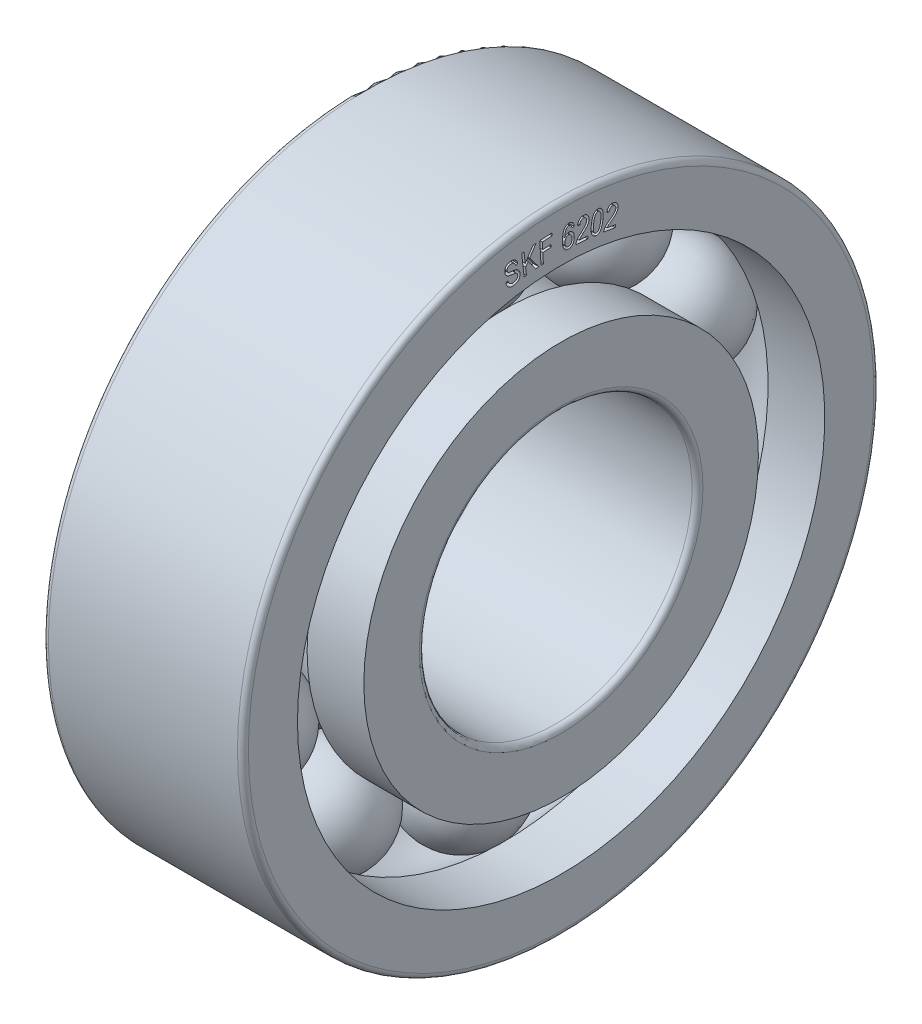
from build123d import *

# Parameters (mm, degrees)
FILLET1_R          = 0.3
FILLET2_R          = 0.3
CIRPATTERN2_COUNT  = 10
CUT_EXTRUDE1_DEPTH = 0.3


with BuildPart() as part:
    # Sketch1 → Revolve1 (revolve)
    with BuildSketch(Plane.XY, mode=Mode.PRIVATE) as revolve1_sk:
        with BuildLine():
            Line((0, 14.5), (3.118955061, 14.5))
            ThreePointArc((3.118955061, 14.5), (5.5, 15.675), (7.881044939, 14.5))
            Line((7.881044939, 14.5), (11, 14.5))
            Line((11, 14.5), (11, 17.5))
            Line((11, 17.5), (0, 17.5))
            Line((0, 17.5), (0, 14.5))
        make_face()
        with BuildLine():
            Line((0, 7.5), (11, 7.5))
            Line((11, 7.5), (11, 10.85))
            Line((11, 10.85), (7.881044939, 10.85))
            ThreePointArc((7.881044939, 10.85), (5.5, 9.675), (3.118955061, 10.85))
            Line((3.118955061, 10.85), (0, 10.85))
            Line((0, 10.85), (0, 7.5))
        make_face()
    revolve(revolve1_sk.sketch.rotate(Axis((0, 0, 0), (1, 0, 0)), 90), axis=Axis((0, 0, 0), (1, 0, 0)))

    # Fillet1
    fillet1_edges = [part.edges().sort_by_distance(p)[0] for p in [
        (0, 0, -17.5),
        (11, 0, -17.5),
    ]]
    fillet(fillet1_edges, radius=FILLET1_R)

    # Fillet2
    fillet2_edges = [part.edges().sort_by_distance(p)[0] for p in [
        (11, 0, -7.5),
        (0, 0, -7.5),
    ]]
    fillet(fillet2_edges, radius=FILLET2_R)

    # Sketch4 → Cut-Extrude1 (cut)
    # profile 1 of 7: a face of its own
    with BuildSketch(Plane(origin=(11, 0, 0), x_dir=(0, 0, -1), z_dir=(1, 0, 0))):
        with BuildLine():
            Line((-3.044063134, 15.181571735), (-2.925231965, 15.215662644))
            add(Edge.make_bspline(
                [(-2.925231965, 15.215662644), (-2.920744006, 15.200541273), (-2.912237957, 15.171881672), (-2.895514226, 15.132702536), (-2.877240484, 15.099030284), (-2.855883638, 15.071077612), (-2.831680525, 15.048058603), (-2.804827891, 15.028471628), (-2.774527306, 15.012732784), (-2.741556454, 15.000118472), (-2.706261244, 14.991242517), (-2.669260918, 14.987288139), (-2.630991469, 14.987367482), (-2.605400164, 14.991002012), (-2.592358588, 14.992854203)],
                knots=[0, 0, 0, 0, 1.267612796, 2.402512161, 3.4195431, 4.341358501, 5.218594019, 6.097382682, 7.005551845, 7.9560457, 8.93134566, 9.923303809, 10.941695633, 12, 12, 12, 12], degree=3))
            add(Edge.make_bspline(
                [(-2.592358588, 14.992854203), (-2.583083437, 14.994699135), (-2.56505888, 14.998284423), (-2.539084797, 15.005230138), (-2.515235244, 15.014110366), (-2.493052312, 15.02404325), (-2.472841549, 15.035641934), (-2.454759767, 15.049014918), (-2.438146008, 15.063310473), (-2.423979454, 15.079490382), (-2.411334208, 15.096418733), (-2.401518815, 15.114611492), (-2.393272681, 15.133185103), (-2.387430368, 15.152570656), (-2.38375825, 15.172664257), (-2.382347308, 15.19340099), (-2.3830325, 15.214873583), (-2.385226198, 15.229233898), (-2.386352095, 15.236604203)],
                knots=[0, 0, 0, 0, 1.260277703, 2.449118939, 3.578544406, 4.648426593, 5.685651549, 6.676659332, 7.642428837, 8.600106263, 9.537029284, 10.45221627, 11.348539389, 12.24172347, 13.143513612, 14.065326012, 15.007045651, 16, 16, 16, 16], degree=3))
            add(Edge.make_bspline(
                [(-2.386352095, 15.236604203), (-2.388099944, 15.245016313), (-2.391499802, 15.261379266), (-2.399861373, 15.284634326), (-2.411066046, 15.305600881), (-2.42487551, 15.324360334), (-2.441243107, 15.340954731), (-2.460200118, 15.355358377), (-2.48210522, 15.367024205), (-2.502362101, 15.375199137), (-2.521336292, 15.381054356), (-2.539329237, 15.384869986), (-2.560628163, 15.389420409), (-2.585496806, 15.393695824), (-2.613833539, 15.398044147), (-2.645675346, 15.402351665), (-2.680867511, 15.407113466), (-2.705581901, 15.409796498), (-2.718494952, 15.411198358)],
                knots=[0, 0, 0, 0, 1.00578208, 1.956413386, 2.883930262, 3.781717625, 4.67612386, 5.606221166, 6.559512649, 7.574959909, 8.161588506, 8.883668903, 9.728572095, 10.713592624, 11.839367262, 13.087477391, 14.478232553, 16, 16, 16, 16], degree=3))
            add(Edge.make_bspline(
                [(-2.718494952, 15.411198358), (-2.730111207, 15.412593068), (-2.752567326, 15.415289268), (-2.784853279, 15.42025746), (-2.814795518, 15.425203553), (-2.842120214, 15.431115819), (-2.867165424, 15.43715936), (-2.889712826, 15.443621275), (-2.909810268, 15.4506685), (-2.933088465, 15.460642506), (-2.959257459, 15.475338116), (-2.98807898, 15.495842741), (-3.013937888, 15.519949263), (-3.037271194, 15.546951334), (-3.05699662, 15.577415657), (-3.073388065, 15.610622409), (-3.085946761, 15.646718339), (-3.091106283, 15.672001322), (-3.093738459, 15.684899657)],
                knots=[0, 0, 0, 0, 1.106872608, 2.139765548, 3.090476005, 3.977646967, 4.784168743, 5.527877926, 6.195841063, 6.797858365, 7.921967416, 9.028093794, 10.136749985, 11.258784669, 12.396246015, 13.560560455, 14.755498598, 16, 16, 16, 16], degree=3))
            add(Edge.make_bspline(
                [(-3.093738459, 15.684899657), (-3.095498911, 15.696645692), (-3.098946252, 15.719646922), (-3.100328387, 15.753984174), (-3.098701896, 15.787171691), (-3.093844472, 15.819250452), (-3.085731433, 15.850171412), (-3.07452925, 15.879990128), (-3.05997674, 15.908659949), (-3.042573669, 15.936080347), (-3.02213887, 15.961702896), (-2.998855606, 15.98476488), (-2.973418831, 16.005864237), (-2.944983318, 16.02365401), (-2.914329591, 16.039460557), (-2.881080726, 16.052460259), (-2.845458131, 16.063374729), (-2.820579131, 16.068165212), (-2.807861835, 16.070613943)],
                knots=[0, 0, 0, 0, 1.053908628, 2.063776814, 3.045189342, 4.000210076, 4.938884772, 5.878527246, 6.822856245, 7.788477227, 8.757534404, 9.725760496, 10.693745172, 11.685344963, 12.697396539, 13.751945616, 14.850871331, 16, 16, 16, 16], degree=3))
            add(Edge.make_bspline(
                [(-2.807861835, 16.070613943), (-2.790287882, 16.073237039), (-2.756077337, 16.078343322), (-2.705355921, 16.0786365), (-2.657052056, 16.073479832), (-2.611439688, 16.061986076), (-2.568789123, 16.044946444), (-2.529666979, 16.02231631), (-2.494173045, 15.994317399), (-2.462975478, 15.960648936), (-2.435908433, 15.92218378), (-2.413070051, 15.879235501), (-2.395253694, 15.831604838), (-2.387282072, 15.797909357), (-2.383186511, 15.780597709)],
                knots=[0, 0, 0, 0, 1.104928803, 2.150922834, 3.147505644, 4.121780742, 5.069460964, 5.99766469, 6.925689606, 7.873059955, 8.844605839, 9.845967959, 10.893327996, 12, 12, 12, 12], degree=3))
            Line((-2.383186511, 15.780597709), (-2.504696251, 15.747967839))
            add(Edge.make_bspline(
                [(-2.504696251, 15.747967839), (-2.507259308, 15.757093933), (-2.512252932, 15.774874379), (-2.521428818, 15.800151425), (-2.532021351, 15.82322342), (-2.543554054, 15.844344773), (-2.556911849, 15.863033056), (-2.570842058, 15.880145398), (-2.586686817, 15.894444655), (-2.603317775, 15.907043457), (-2.621163799, 15.917612953), (-2.640348884, 15.92587729), (-2.66067176, 15.932236697), (-2.682215192, 15.936575004), (-2.704955682, 15.939062979), (-2.728832291, 15.939152141), (-2.75390811, 15.937479758), (-2.770864265, 15.934867786), (-2.779615082, 15.933519787)],
                knots=[0, 0, 0, 0, 1.217044617, 2.371178038, 3.44863032, 4.475219422, 5.455520998, 6.395076558, 7.302394348, 8.188386159, 9.071491496, 9.958402545, 10.865001572, 11.80125566, 12.776222827, 13.797772447, 14.863463348, 16, 16, 16, 16], degree=3))
            add(Edge.make_bspline(
                [(-2.779615082, 15.933519787), (-2.788404403, 15.931843272), (-2.805453771, 15.928591198), (-2.82999157, 15.922036468), (-2.852531919, 15.913926669), (-2.8734669, 15.905085684), (-2.892172847, 15.894496257), (-2.909267638, 15.883033687), (-2.924388906, 15.870125838), (-2.937497443, 15.855974334), (-2.94880074, 15.841069059), (-2.958143321, 15.825396434), (-2.965384044, 15.80909889), (-2.970915134, 15.792310539), (-2.974208092, 15.774874648), (-2.976040069, 15.756859473), (-2.975503744, 15.73821818), (-2.973655474, 15.725794387), (-2.972715731, 15.719477579)],
                knots=[0, 0, 0, 0, 1.321212232, 2.562864017, 3.745783213, 4.857048809, 5.914241528, 6.915016841, 7.892769388, 8.842717789, 9.758548159, 10.650774574, 11.530757582, 12.387490864, 13.25497488, 14.145992589, 15.057340313, 16, 16, 16, 16], degree=3))
            add(Edge.make_bspline(
                [(-2.972715731, 15.719477579), (-2.970307904, 15.708218332), (-2.965705782, 15.686698338), (-2.952178763, 15.657765436), (-2.934700653, 15.633056402), (-2.919086256, 15.621315727), (-2.911352095, 15.615500306)],
                knots=[0, 0, 0, 0, 1.109838427, 2.121253341, 3.069414597, 4, 4, 4, 4], degree=3))
            add(Edge.make_bspline(
                [(-2.911352095, 15.615500306), (-2.906777647, 15.612802833), (-2.8968737, 15.606962646), (-2.87960413, 15.599766035), (-2.858986994, 15.593389569), (-2.835299443, 15.587048804), (-2.808308599, 15.581458662), (-2.778036466, 15.576807619), (-2.744544549, 15.572018401), (-2.721022445, 15.569708344), (-2.708754692, 15.568503553)],
                knots=[0, 0, 0, 0, 0.607880077, 1.316095631, 2.136599762, 3.079461519, 4.124508814, 5.292527827, 6.587940934, 8, 8, 8, 8], degree=3))
            add(Edge.make_bspline(
                [(-2.708754692, 15.568503553), (-2.696655621, 15.567331627), (-2.673332366, 15.565072516), (-2.639746327, 15.561077831), (-2.608872636, 15.557307437), (-2.580779227, 15.553171788), (-2.555463202, 15.548774492), (-2.532818815, 15.544375468), (-2.512847157, 15.540208177), (-2.500622341, 15.536747315), (-2.494955991, 15.535143164)],
                knots=[0, 0, 0, 0, 1.346566934, 2.59576324, 3.746763071, 4.792070397, 5.741132501, 6.59289962, 7.347791901, 8, 8, 8, 8], degree=3))
            add(Edge.make_bspline(
                [(-2.494955991, 15.535143164), (-2.479438718, 15.529889892), (-2.449284034, 15.519681221), (-2.407897988, 15.497539714), (-2.371276157, 15.471165451), (-2.339398508, 15.440141384), (-2.312708355, 15.404408766), (-2.290790294, 15.364321397), (-2.274368283, 15.31945264), (-2.267761642, 15.287603261), (-2.264355342, 15.271182125)],
                knots=[0, 0, 0, 0, 1.058340027, 2.056669818, 3.022999804, 3.969902062, 4.922451364, 5.897657698, 6.916058901, 8, 8, 8, 8], degree=3))
            add(Edge.make_bspline(
                [(-2.264355342, 15.271182125), (-2.262070724, 15.254496035), (-2.257559577, 15.221548099), (-2.258116142, 15.172048169), (-2.265254001, 15.123824875), (-2.278638584, 15.07751522), (-2.297533834, 15.033910651), (-2.321796903, 14.99394197), (-2.351621683, 14.958367722), (-2.386443892, 14.926933017), (-2.426544123, 14.900170283), (-2.471994927, 14.878596038), (-2.522263613, 14.861069692), (-2.55807547, 14.853869782), (-2.576530666, 14.850159397)],
                knots=[0, 0, 0, 0, 1.027248029, 2.028378232, 3.010299039, 3.995328995, 4.962989097, 5.9038825, 6.839816256, 7.787251894, 8.759027696, 9.771974256, 10.851814584, 12, 12, 12, 12], degree=3))
            add(Edge.make_bspline(
                [(-2.576530666, 14.850159397), (-2.591194638, 14.847960083), (-2.61993204, 14.843650023), (-2.662556732, 14.841574026), (-2.7034844, 14.842849467), (-2.742747759, 14.848217204), (-2.780349307, 14.857516363), (-2.816302041, 14.870402432), (-2.850499489, 14.887170034), (-2.88278981, 14.907527974), (-2.91273095, 14.931485972), (-2.940164466, 14.958328305), (-2.964683631, 14.988333118), (-2.98631691, 15.021252201), (-3.005194347, 15.057150277), (-3.021164918, 15.095885024), (-3.034474041, 15.137589935), (-3.040811337, 15.166656883), (-3.044063134, 15.181571735)],
                knots=[0, 0, 0, 0, 1.102136748, 2.159888731, 3.168604515, 4.143502833, 5.100978055, 6.044229046, 6.978299524, 7.927845406, 8.877161021, 9.824767072, 10.77697616, 11.753032426, 12.749390929, 13.788567497, 14.865268245, 16, 16, 16, 16], degree=3))
        make_face()
    # profile 2 of 7: a face of its own
    with BuildSketch(Plane(origin=(11, 0, 0), x_dir=(0, 0, -1), z_dir=(1, 0, 0))):
        Polygon((-2.034825648, 14.959622387), (-2.16875422, 16.153291218), (-2.039452272, 16.167658101), (-1.972974999, 15.575693816), (-1.553169804, 16.222203556), (-1.377358116, 16.241927582), (-1.734338635, 15.712300959), (-1.225653571, 15.050206803), (-1.396595129, 15.03096979), (-1.812747726, 15.596148361), (-1.951789934, 15.387706803), (-1.9055237, 14.97398927), align=None)
    # profile 3 of 7: a face of its own
    with BuildSketch(Plane(origin=(11, 0, 0), x_dir=(0, 0, -1), z_dir=(1, 0, 0))):
        Polygon((-1.10622767, 15.056548843), (-1.169295852, 16.261418972), (-0.502818579, 16.296483907), (-0.495513385, 16.154276115), (-1.03122767, 16.126029362), (-1.011747151, 15.752977414), (-0.548354294, 15.777328063), (-0.540805592, 15.635120271), (-1.004198449, 15.610769622), (-0.975464683, 15.063367024), align=None)
    # profile 4 of 7: a face of its own
    with BuildSketch(Plane(origin=(11, 0, 0), x_dir=(0, 0, -1), z_dir=(1, 0, 0))):
        with BuildLine():
            Line((0.719140197, 15.991960262), (0.598117469, 15.983681041))
            add(Edge.make_bspline(
                [(0.598117469, 15.983681041), (0.595541033, 15.998189258), (0.59073084, 16.025276014), (0.58015033, 16.062227329), (0.567451286, 16.092856599), (0.555929817, 16.109480866), (0.550633703, 16.1171226)],
                knots=[0, 0, 0, 0, 1.235540605, 2.306747092, 3.221656562, 4, 4, 4, 4], degree=3))
            add(Edge.make_bspline(
                [(0.550633703, 16.1171226), (0.546670551, 16.121838528), (0.538972814, 16.130998403), (0.526036229, 16.143010634), (0.512755609, 16.153610898), (0.498567228, 16.162140051), (0.483757571, 16.168805891), (0.468311653, 16.173676206), (0.452140135, 16.176930284), (0.441070642, 16.17763946), (0.435455132, 16.177999223)],
                knots=[0, 0, 0, 0, 1.096389745, 2.129547604, 3.139059807, 4.118612582, 5.07001139, 6.025795559, 6.998493737, 8, 8, 8, 8], degree=3))
            add(Edge.make_bspline(
                [(0.435455132, 16.177999223), (0.426742766, 16.177798348), (0.409626944, 16.177403719), (0.384454845, 16.171848365), (0.36066174, 16.16201429), (0.338185298, 16.14774974), (0.316996012, 16.129532989), (0.296814612, 16.107399973), (0.278354073, 16.080775319), (0.267500994, 16.061139808), (0.261835002, 16.050888834)],
                knots=[0, 0, 0, 0, 0.916828197, 1.801148762, 2.698776775, 3.617399352, 4.594511704, 5.636121762, 6.765906495, 8, 8, 8, 8], degree=3))
            add(Edge.make_bspline(
                [(0.261835002, 16.050888834), (0.25712757, 16.041055895), (0.247338838, 16.020609076), (0.235353825, 15.987323502), (0.224856805, 15.950637088), (0.216321758, 15.910485296), (0.208925904, 15.866959466), (0.20347034, 15.820057731), (0.199582005, 15.769690625), (0.198242107, 15.734986074), (0.197549287, 15.717041431)],
                knots=[0, 0, 0, 0, 0.76337834, 1.587385, 2.474751449, 3.435135224, 4.46164866, 5.566953116, 6.741947227, 8, 8, 8, 8], degree=3))
            add(Edge.make_bspline(
                [(0.197549287, 15.717041431), (0.204940077, 15.729437243), (0.219280889, 15.753489615), (0.245571809, 15.785056748), (0.273844434, 15.812303761), (0.304937324, 15.834189299), (0.337540724, 15.85128772), (0.371247933, 15.86349425), (0.405877257, 15.870228106), (0.429177849, 15.870701274), (0.440812274, 15.870937535)],
                knots=[0, 0, 0, 0, 1.142323569, 2.216522233, 3.245031075, 4.246481223, 5.219142673, 6.155242185, 7.07887762, 8, 8, 8, 8], degree=3))
            add(Edge.make_bspline(
                [(0.440812274, 15.870937535), (0.450414889, 15.870346579), (0.469527231, 15.869170385), (0.497612314, 15.863500165), (0.524678237, 15.854397386), (0.550561601, 15.841887798), (0.575423628, 15.826050137), (0.599260491, 15.807037344), (0.622027813, 15.78462169), (0.643527836, 15.759242305), (0.663207185, 15.731104569), (0.680351251, 15.700558068), (0.694447723, 15.66769682), (0.705888513, 15.632730029), (0.714653903, 15.595676091), (0.720463388, 15.556417808), (0.723364957, 15.51497638), (0.723147631, 15.48660692), (0.7230363, 15.472073898)],
                knots=[0, 0, 0, 0, 0.849414053, 1.690611606, 2.523048206, 3.36678009, 4.224421908, 5.122816814, 6.056096836, 7.043381196, 8.058187099, 9.085789413, 10.13310385, 11.212781912, 12.333195594, 13.493668837, 14.71606423, 16, 16, 16, 16], degree=3))
            add(Edge.make_bspline(
                [(0.7230363, 15.472073898), (0.721942699, 15.452397856), (0.719797791, 15.413806757), (0.710381082, 15.357459156), (0.69475541, 15.304272302), (0.677806006, 15.262333125), (0.661803285, 15.230861476), (0.648893375, 15.209079445), (0.635545656, 15.188734585), (0.621329555, 15.170081663), (0.606289883, 15.153051856), (0.590442285, 15.137728853), (0.573986573, 15.123881476), (0.551273404, 15.107939906), (0.521346799, 15.09165737), (0.48347342, 15.077793506), (0.443811822, 15.070067429), (0.416899737, 15.069566878), (0.403312274, 15.069314158)],
                knots=[0, 0, 0, 0, 1.650564514, 3.237292058, 4.774211134, 6.287377236, 7.020482092, 7.730896192, 8.408137686, 9.058405411, 9.694430396, 10.310127458, 10.904062605, 11.494717179, 12.63304645, 13.747616634, 14.862809262, 16, 16, 16, 16], degree=3))
            add(Edge.make_bspline(
                [(0.403312274, 15.069314158), (0.39110603, 15.070089508), (0.367070631, 15.071616255), (0.3319794, 15.07870386), (0.298785247, 15.090299973), (0.267329726, 15.106091459), (0.237517153, 15.125889554), (0.209479731, 15.149964174), (0.183831647, 15.178627119), (0.159085287, 15.210750075), (0.137176398, 15.2482656), (0.119048923, 15.291362239), (0.103260408, 15.339679733), (0.091453266, 15.393630587), (0.082452489, 15.45309288), (0.076942102, 15.517996956), (0.073799455, 15.588442615), (0.074632509, 15.637168707), (0.075065521, 15.662495976)],
                knots=[0, 0, 0, 0, 0.772673074, 1.52147582, 2.2550707, 2.989490832, 3.741014431, 4.512510676, 5.318924068, 6.168779388, 7.072710829, 8.056540885, 9.119541585, 10.28235962, 11.543788499, 12.919534669, 14.398809097, 16, 16, 16, 16], degree=3))
            add(Edge.make_bspline(
                [(0.075065521, 15.662495976), (0.076152341, 15.690591189), (0.07824368, 15.744654081), (0.084667485, 15.822610667), (0.094405286, 15.894110108), (0.106529348, 15.959421625), (0.122036966, 16.018291277), (0.140419269, 16.070785464), (0.161467575, 16.117181852), (0.185993779, 16.157113381), (0.21283887, 16.191460716), (0.24103171, 16.22124878), (0.271316765, 16.246035039), (0.302983582, 16.266500345), (0.336462382, 16.281943194), (0.371458401, 16.292883318), (0.408223041, 16.29873146), (0.43324436, 16.299085844), (0.445925911, 16.299265457)],
                knots=[0, 0, 0, 0, 1.64164554, 3.158976043, 4.565248894, 5.853594187, 7.03542232, 8.116222204, 9.098046738, 10.004396832, 10.845334297, 11.639789507, 12.394111963, 13.125129061, 13.835512214, 14.54010076, 15.260079557, 16, 16, 16, 16], degree=3))
            add(Edge.make_bspline(
                [(0.445925911, 16.299265457), (0.455109784, 16.298764004), (0.473237149, 16.297774225), (0.499814116, 16.293758157), (0.52502883, 16.286764574), (0.54913552, 16.277758236), (0.571974281, 16.266309007), (0.593730703, 16.252507513), (0.61407777, 16.236196041), (0.633133404, 16.217581082), (0.650735024, 16.196901569), (0.666386396, 16.173866495), (0.679892431, 16.148629217), (0.692102524, 16.12149327), (0.701474175, 16.09198272), (0.709794218, 16.060603039), (0.715427125, 16.026996064), (0.717882788, 16.00382492), (0.719140197, 15.991960262)],
                knots=[0, 0, 0, 0, 0.96863511, 1.911916787, 2.824589693, 3.720281907, 4.618907886, 5.510796371, 6.42953733, 7.360727652, 8.313226594, 9.285590786, 10.288054085, 11.325533566, 12.41522238, 13.545486257, 14.743179532, 16, 16, 16, 16], degree=3))
        make_face()
        with BuildLine():
            add(Edge.make_bspline(
                [(0.210211625, 15.485466756), (0.210176624, 15.474832042), (0.210108424, 15.454110247), (0.211949531, 15.423737155), (0.21613349, 15.394931468), (0.222191393, 15.367566138), (0.230168889, 15.341708519), (0.240231442, 15.317434921), (0.252121047, 15.294713391), (0.266004365, 15.273813256), (0.281245931, 15.255045847), (0.297092437, 15.238306574), (0.313630578, 15.22400727), (0.331176204, 15.21255159), (0.349168182, 15.203037734), (0.368120105, 15.196660287), (0.387500906, 15.191897803), (0.400767076, 15.191183723), (0.407451885, 15.190823898)],
                knots=[0, 0, 0, 0, 1.299750469, 2.5325705, 3.715391188, 4.853942041, 5.955403988, 7.018530149, 8.061464983, 9.085108799, 10.079881538, 11.013185547, 11.899923021, 12.744705771, 13.570038526, 14.379596453, 15.18348048, 16, 16, 16, 16], degree=3))
            add(Edge.make_bspline(
                [(0.407451885, 15.190823898), (0.413306393, 15.1909183), (0.425010899, 15.191107029), (0.442412612, 15.19407727), (0.459414978, 15.199566647), (0.476022147, 15.207312647), (0.491909921, 15.217852563), (0.507637829, 15.23023669), (0.522616635, 15.245336981), (0.537552925, 15.26214306), (0.550998321, 15.281428612), (0.563399375, 15.302365796), (0.573404237, 15.325470124), (0.582332123, 15.350036716), (0.589053826, 15.376568405), (0.594107083, 15.404806834), (0.59757209, 15.434902505), (0.598414547, 15.455587423), (0.598847989, 15.466229743)],
                knots=[0, 0, 0, 0, 0.757741623, 1.514899357, 2.276425345, 3.066665923, 3.880412433, 4.740914924, 5.655483865, 6.631800761, 7.650026193, 8.696050619, 9.778642872, 10.906110933, 12.079283158, 13.318857309, 14.620561263, 16, 16, 16, 16], degree=3))
            add(Edge.make_bspline(
                [(0.598847989, 15.466229743), (0.598997761, 15.476622338), (0.599289425, 15.496860632), (0.597225688, 15.526384991), (0.593667833, 15.554136041), (0.58834193, 15.580224295), (0.581071882, 15.604503827), (0.572082812, 15.627029631), (0.561275114, 15.647789355), (0.548617236, 15.666590073), (0.534906753, 15.683701501), (0.519827789, 15.698316879), (0.504370819, 15.711159406), (0.487752032, 15.721468204), (0.470470163, 15.729790038), (0.452272963, 15.736023462), (0.433151852, 15.739607056), (0.420127564, 15.740469049), (0.413539547, 15.740905067)],
                knots=[0, 0, 0, 0, 1.347745706, 2.624568131, 3.835250282, 4.975137262, 6.074424626, 7.118522008, 8.116971582, 9.104030352, 10.054526029, 10.955439728, 11.823705025, 12.656316134, 13.485190551, 14.30761971, 15.143950817, 16, 16, 16, 16], degree=3))
            add(Edge.make_bspline(
                [(0.413539547, 15.740905067), (0.407039401, 15.740793906), (0.394223784, 15.740574741), (0.375199991, 15.737942536), (0.356904916, 15.732629114), (0.338904135, 15.725639131), (0.321625848, 15.716037963), (0.304969201, 15.704192621), (0.28885994, 15.690293296), (0.273605039, 15.674174017), (0.259271923, 15.656408513), (0.246803748, 15.636678245), (0.235997079, 15.615444294), (0.227348259, 15.592441528), (0.220246855, 15.567939567), (0.21490632, 15.541892218), (0.211507705, 15.514200895), (0.210651383, 15.49521621), (0.210211625, 15.485466756)],
                knots=[0, 0, 0, 0, 0.858481058, 1.692571738, 2.527764619, 3.370086657, 4.238754399, 5.131318716, 6.06647714, 7.044902503, 8.059787584, 9.077162351, 10.122632511, 11.202034395, 12.318564027, 13.489978003, 14.710995372, 16, 16, 16, 16], degree=3))
        make_face(mode=Mode.SUBTRACT)
    # profile 5 of 7: a face of its own
    with BuildSketch(Plane(origin=(11, 0, 0), x_dir=(0, 0, -1), z_dir=(1, 0, 0))):
        with BuildLine():
            Line((1.477615486, 15.169123317), (1.466657694, 15.026915525))
            Line((1.466657694, 15.026915525), (0.813329772, 15.077077862))
            add(Edge.make_bspline(
                [(0.813329772, 15.077077862), (0.813846517, 15.084398655), (0.814897314, 15.099285421), (0.819012982, 15.121717586), (0.824614551, 15.144648509), (0.8319294, 15.168104784), (0.841234895, 15.192007521), (0.85253528, 15.216317112), (0.865429752, 15.241241624), (0.880471131, 15.266756153), (0.89769456, 15.293189398), (0.918219957, 15.320137908), (0.940936848, 15.348541105), (0.967282411, 15.377401553), (0.99617702, 15.407617488), (1.028068704, 15.438662171), (1.062814915, 15.470743735), (1.087297102, 15.49199763), (1.099936915, 15.502970719)],
                knots=[0, 0, 0, 0, 0.668246438, 1.358873191, 2.074586421, 2.818443611, 3.595812199, 4.409887891, 5.260018928, 6.151726696, 7.107617745, 8.132676683, 9.236907014, 10.4204661, 11.691532815, 13.046095329, 14.474940143, 16, 16, 16, 16], degree=3))
            add(Edge.make_bspline(
                [(1.099936915, 15.502970719), (1.114608459, 15.515563731), (1.142886815, 15.539835865), (1.182732308, 15.575996624), (1.219081537, 15.609616127), (1.251259779, 15.641423791), (1.279809019, 15.670774151), (1.304550698, 15.698036909), (1.325314086, 15.723289677), (1.34733826, 15.753590588), (1.369396642, 15.789710534), (1.389597195, 15.83240283), (1.403563642, 15.874188556), (1.407024437, 15.902150741), (1.408703149, 15.915714226)],
                knots=[0, 0, 0, 0, 1.3182749, 2.54088094, 3.668638528, 4.693996643, 5.625533222, 6.460212433, 7.203585683, 7.853409707, 9.013302046, 10.082889045, 11.070076016, 12, 12, 12, 12], degree=3))
            add(Edge.make_bspline(
                [(1.408703149, 15.915714226), (1.409174745, 15.923260523), (1.410092631, 15.937948173), (1.40898514, 15.959624314), (1.406354728, 15.980313235), (1.402059903, 16.000185909), (1.395568583, 16.019039822), (1.387665062, 16.037064605), (1.377702503, 16.054013202), (1.366437812, 16.070030356), (1.353526369, 16.084463104), (1.339866182, 16.097552679), (1.32515579, 16.10879393), (1.309552007, 16.118404841), (1.292817874, 16.125949299), (1.275263602, 16.131757387), (1.256839639, 16.136021568), (1.244194395, 16.137356538), (1.23776159, 16.138035654)],
                knots=[0, 0, 0, 0, 1.15651879, 2.250977219, 3.315840549, 4.346749669, 5.356478648, 6.363145516, 7.354048434, 8.360715302, 9.355349862, 10.313303165, 11.25262522, 12.183777309, 13.112273226, 14.055203656, 15.010656087, 16, 16, 16, 16], degree=3))
            add(Edge.make_bspline(
                [(1.23776159, 16.138035654), (1.230861934, 16.138444325), (1.217292499, 16.139248052), (1.197219816, 16.137601558), (1.177899599, 16.134359575), (1.159485087, 16.128600531), (1.141840285, 16.121037471), (1.124972204, 16.111440924), (1.10876374, 16.100007233), (1.09379519, 16.08630244), (1.079758093, 16.070941364), (1.067328091, 16.053495836), (1.056381959, 16.034250028), (1.04709581, 16.013194133), (1.039660373, 15.990292236), (1.033236517, 15.965697461), (1.028634336, 15.939140907), (1.026995441, 15.920762121), (1.026154447, 15.911331109)],
                knots=[0, 0, 0, 0, 0.948277095, 1.864960472, 2.759475751, 3.634106525, 4.508097508, 5.391777403, 6.295142638, 7.226623035, 8.17385086, 9.14850274, 10.162166007, 11.210433554, 12.303402196, 13.46619028, 14.699784131, 16, 16, 16, 16], degree=3))
            Line((1.026154447, 15.911331109), (0.902453149, 15.936655784))
            add(Edge.make_bspline(
                [(0.902453149, 15.936655784), (0.904775845, 15.950574393), (0.909302783, 15.977701774), (0.919108925, 16.016571116), (0.930744228, 16.052680091), (0.944592621, 16.08583982), (0.960511464, 16.116205619), (0.978122952, 16.143931184), (0.998359895, 16.168407436), (1.020247802, 16.190184976), (1.044072282, 16.20904731), (1.069377164, 16.225115302), (1.096124384, 16.238406872), (1.124375445, 16.248707353), (1.154110778, 16.255969516), (1.185353896, 16.260256628), (1.217954737, 16.262114899), (1.240117555, 16.260896204), (1.251397954, 16.260275914)],
                knots=[0, 0, 0, 0, 1.269962823, 2.475158619, 3.605189177, 4.682777464, 5.705863767, 6.688942832, 7.633967697, 8.558917078, 9.463935715, 10.364043615, 11.252958119, 12.147621138, 13.065703602, 14.003040482, 14.983590425, 16, 16, 16, 16], degree=3))
            add(Edge.make_bspline(
                [(1.251397954, 16.260275914), (1.263610776, 16.259069631), (1.287415169, 16.256718427), (1.321587137, 16.24903717), (1.353276026, 16.238584892), (1.382421215, 16.225204164), (1.40905946, 16.20874732), (1.433018057, 16.189158883), (1.454480496, 16.166501129), (1.472891826, 16.140934488), (1.489119868, 16.113846908), (1.502794274, 16.08569777), (1.514002388, 16.056941771), (1.522865899, 16.027481267), (1.529228256, 15.997348265), (1.532794129, 15.96646019), (1.534132851, 15.934943556), (1.532984974, 15.913763475), (1.532404447, 15.903051888)],
                knots=[0, 0, 0, 0, 1.152646897, 2.246659997, 3.284114026, 4.284316235, 5.25399303, 6.219187172, 7.185255406, 8.178683632, 9.174423691, 10.150323714, 11.116602818, 12.072464167, 13.039104655, 14.007219391, 14.992173723, 16, 16, 16, 16], degree=3))
            add(Edge.make_bspline(
                [(1.532404447, 15.903051888), (1.531489067, 15.893536499), (1.52965702, 15.87449234), (1.524409395, 15.846372692), (1.51760658, 15.81861199), (1.508824446, 15.791352443), (1.498108212, 15.764489897), (1.485273963, 15.738173249), (1.471067445, 15.712082762), (1.454321354, 15.686310942), (1.43488501, 15.659805595), (1.41229996, 15.631693231), (1.386012283, 15.601680386), (1.356413048, 15.569571535), (1.322911722, 15.535752364), (1.285789686, 15.499976176), (1.245292264, 15.462043483), (1.21671187, 15.436515153), (1.201966136, 15.423344096)],
                knots=[0, 0, 0, 0, 0.76675058, 1.534579319, 2.292845267, 3.059097723, 3.83075688, 4.611488905, 5.407343519, 6.213130973, 7.07557705, 8.04396437, 9.105818799, 10.276554525, 11.547741168, 12.925016406, 14.413496595, 16, 16, 16, 16], degree=3))
            add(Edge.make_bspline(
                [(1.201966136, 15.423344096), (1.192607867, 15.415172885), (1.174719115, 15.399553248), (1.149496611, 15.37678242), (1.126427165, 15.35645347), (1.10635206, 15.337712659), (1.088811963, 15.321076938), (1.073536469, 15.306730834), (1.061004465, 15.294171568), (1.042156088, 15.274462883), (1.01836188, 15.246300321), (1.001129687, 15.219394707), (0.992794058, 15.20637981)],
                knots=[0, 0, 0, 0, 1.231581042, 2.354222638, 3.368608538, 4.279620457, 5.076521058, 5.765201485, 6.35694331, 6.835024083, 8.469024606, 10, 10, 10, 10], degree=3))
            Line((0.992794058, 15.20637981), (1.477615486, 15.169123317))
        make_face()
    # profile 6 of 7: a face of its own
    with BuildSketch(Plane(origin=(11, 0, 0), x_dir=(0, 0, -1), z_dir=(1, 0, 0))):
        with BuildLine():
            add(Edge.make_bspline(
                [(1.663243303, 15.603696424), (1.666514018, 15.627919589), (1.672867712, 15.674975551), (1.685706594, 15.742750963), (1.699798433, 15.805827289), (1.716431241, 15.863809103), (1.734618908, 15.917117694), (1.754579612, 15.965709612), (1.777089821, 16.009185643), (1.801144037, 16.047947133), (1.827068306, 16.081839306), (1.855357123, 16.110297344), (1.885073678, 16.134053024), (1.916880903, 16.152282636), (1.950429906, 16.165437174), (1.985828962, 16.17316125), (2.023085211, 16.176020623), (2.048236806, 16.17371154), (2.061132914, 16.172527592)],
                knots=[0, 0, 0, 0, 1.516727272, 2.946396923, 4.279626609, 5.526531295, 6.687883514, 7.77404945, 8.783414732, 9.722678397, 10.602341715, 11.42518562, 12.207218345, 12.956386855, 13.69167434, 14.434771927, 15.197452456, 16, 16, 16, 16], degree=3))
            add(Edge.make_bspline(
                [(2.061132914, 16.172527592), (2.072481821, 16.170712397), (2.094693937, 16.167159692), (2.126404849, 16.15689169), (2.155946801, 16.14334067), (2.18282598, 16.125547651), (2.207569289, 16.104374936), (2.229622753, 16.079337847), (2.2497355, 16.050872527), (2.260423681, 16.029743928), (2.265921875, 16.018874995)],
                knots=[0, 0, 0, 0, 1.027868597, 2.011747423, 2.974291095, 3.929893653, 4.888587354, 5.882164803, 6.910547283, 8, 8, 8, 8], degree=3))
            add(Edge.make_bspline(
                [(2.265921875, 16.018874995), (2.272196789, 16.00447299), (2.2852534, 15.974505826), (2.298573475, 15.925048332), (2.308814092, 15.870679133), (2.314960053, 15.810981797), (2.317193864, 15.746080276), (2.315812479, 15.675949509), (2.311016979, 15.600526891), (2.304891267, 15.54872075), (2.301717329, 15.521878242)],
                knots=[0, 0, 0, 0, 0.746609767, 1.553518177, 2.429925938, 3.377631969, 4.405696637, 5.518171088, 6.714080806, 8, 8, 8, 8], degree=3))
            add(Edge.make_bspline(
                [(2.301717329, 15.521878242), (2.298454253, 15.497734655), (2.292126627, 15.45091639), (2.279192812, 15.383403605), (2.265171166, 15.320475685), (2.248518617, 15.262499841), (2.230397409, 15.209246659), (2.210335234, 15.160772754), (2.187791113, 15.117336782), (2.163924529, 15.078359167), (2.137774823, 15.044579173), (2.110008664, 15.015670921), (2.079996553, 14.992205278), (2.048026589, 14.974064054), (2.01440747, 14.960621783), (1.978814963, 14.952811407), (1.941458449, 14.950371132), (1.916235083, 14.952625263), (1.903340706, 14.953777592)],
                knots=[0, 0, 0, 0, 1.511999373, 2.932007875, 4.265464925, 5.512582254, 6.674132527, 7.755835317, 8.765372733, 9.709069863, 10.588883196, 11.411929114, 12.190989583, 12.944660382, 13.686602756, 14.429827068, 15.197315593, 16, 16, 16, 16], degree=3))
            add(Edge.make_bspline(
                [(1.903340706, 14.953777592), (1.891995072, 14.955683788), (1.869601973, 14.959446083), (1.83737822, 14.970007205), (1.807488665, 14.985060685), (1.77973795, 15.00398323), (1.754159341, 15.026872864), (1.730955814, 15.054013582), (1.70976127, 15.08512701), (1.690548738, 15.120456608), (1.674328627, 15.160988186), (1.661831231, 15.207140469), (1.653352502, 15.259124705), (1.64815939, 15.316813403), (1.646219594, 15.380323515), (1.648555539, 15.449712924), (1.653760316, 15.524878282), (1.660003845, 15.57677157), (1.663243303, 15.603696424)],
                knots=[0, 0, 0, 0, 0.714888143, 1.410988672, 2.099634217, 2.789998769, 3.494380542, 4.228183172, 5.005390261, 5.832208964, 6.724732779, 7.714396941, 8.800046895, 9.996709646, 11.315043267, 12.749447248, 14.313449375, 16, 16, 16, 16], degree=3))
        make_face()
        with BuildLine():
            add(Edge.make_bspline(
                [(1.786214083, 15.588112008), (1.783410086, 15.564830531), (1.778043651, 15.520273214), (1.772329291, 15.456210765), (1.76936077, 15.397968869), (1.768716337, 15.34548047), (1.770555893, 15.298651032), (1.774624114, 15.257495691), (1.781539433, 15.222060515), (1.791083539, 15.192026303), (1.802850331, 15.166498334), (1.815662644, 15.144262224), (1.829854546, 15.124949743), (1.845621869, 15.108700696), (1.862636262, 15.095169392), (1.881179949, 15.084728097), (1.901232023, 15.077572482), (1.915225262, 15.075088318), (1.922334212, 15.073826294)],
                knots=[0, 0, 0, 0, 1.92524276, 3.684630942, 5.27939392, 6.712270426, 7.992917336, 9.125546391, 10.104466034, 10.951691622, 11.706195795, 12.408002132, 13.055773063, 13.66844961, 14.261717916, 14.834572438, 15.407930671, 16, 16, 16, 16], degree=3))
            add(Edge.make_bspline(
                [(1.922334212, 15.073826294), (1.929149918, 15.073276654), (1.942570871, 15.072194345), (1.962781555, 15.074500289), (1.98231585, 15.080292794), (2.001621061, 15.088840445), (2.020263879, 15.10109981), (2.038423146, 15.116448548), (2.056089752, 15.135069372), (2.073690456, 15.156946795), (2.090574604, 15.183827776), (2.105812214, 15.216660077), (2.12037788, 15.25533952), (2.13390335, 15.300105774), (2.146381385, 15.350937934), (2.158030841, 15.407885255), (2.168676524, 15.470837929), (2.174656571, 15.514959669), (2.177772524, 15.53794967)],
                knots=[0, 0, 0, 0, 0.565626871, 1.113788135, 1.673667147, 2.248693685, 2.856906975, 3.515714823, 4.214995722, 4.980759669, 5.839165754, 6.837975793, 7.97473484, 9.261939857, 10.710537211, 12.310611936, 14.077613549, 16, 16, 16, 16], degree=3))
            add(Edge.make_bspline(
                [(2.177772524, 15.53794967), (2.180574958, 15.561230934), (2.185948067, 15.605868124), (2.191686437, 15.670014323), (2.194500199, 15.728418116), (2.1956901, 15.78099285), (2.193355715, 15.827811916), (2.189355125, 15.868887756), (2.182477831, 15.904172338), (2.172919433, 15.93405072), (2.16106029, 15.959361779), (2.148355247, 15.981636085), (2.133869343, 16.000872831), (2.117960562, 16.017048226), (2.10071912, 16.0305607), (2.081819301, 16.040721938), (2.061591483, 16.048325144), (2.047391708, 16.050758158), (2.040191355, 16.051991878)],
                knots=[0, 0, 0, 0, 1.922126512, 3.685295166, 5.277476818, 6.714764215, 7.993632502, 9.117812429, 10.095147567, 10.93467164, 11.681906596, 12.382576971, 13.033291449, 13.649626594, 14.237847232, 14.821421117, 15.402372013, 16, 16, 16, 16], degree=3))
            add(Edge.make_bspline(
                [(2.040191355, 16.051991878), (2.033457703, 16.052536033), (2.020119881, 16.053613879), (2.000055219, 16.051355776), (1.980641257, 16.045458034), (1.961308951, 16.037025515), (1.942937301, 16.024482375), (1.924646277, 16.009319105), (1.907259026, 15.990493794), (1.889556129, 15.968642137), (1.872706319, 15.941850729), (1.857705469, 15.909033865), (1.843042234, 15.870529081), (1.82997129, 15.82573046), (1.817271563, 15.774985527), (1.805717413, 15.718104787), (1.795360519, 15.655121244), (1.789351646, 15.611098635), (1.786214083, 15.588112008)],
                knots=[0, 0, 0, 0, 0.56005381, 1.109338317, 1.663890282, 2.240095114, 2.853233004, 3.503895644, 4.209486902, 4.976819985, 5.836985039, 6.82886037, 7.967948763, 9.25583535, 10.700861541, 12.310816766, 14.073674365, 16, 16, 16, 16], degree=3))
        make_face(mode=Mode.SUBTRACT)
    # profile 7 of 7: a face of its own
    with BuildSketch(Plane(origin=(11, 0, 0), x_dir=(0, 0, -1), z_dir=(1, 0, 0))):
        with BuildLine():
            Line((2.998307522, 14.941892654), (2.973226353, 14.802363433))
            Line((2.973226353, 14.802363433), (2.332073756, 14.917785511))
            add(Edge.make_bspline(
                [(2.332073756, 14.917785511), (2.333331898, 14.924955215), (2.335901254, 14.939597059), (2.342129276, 14.961368809), (2.349967833, 14.983512338), (2.35978803, 15.005940637), (2.371433802, 15.028696725), (2.384962606, 15.051764864), (2.400333872, 15.075020917), (2.417434404, 15.098968284), (2.43735114, 15.123139679), (2.460083617, 15.147946457), (2.485618287, 15.1736139), (2.514591859, 15.199427872), (2.545888559, 15.22674954), (2.58075842, 15.253948893), (2.618416616, 15.28213939), (2.64476947, 15.300724563), (2.658372457, 15.310317979)],
                knots=[0, 0, 0, 0, 0.666618282, 1.361356283, 2.071802122, 2.81794784, 3.602968221, 4.412994278, 5.267034655, 6.156733402, 7.108118908, 8.134763256, 9.239204543, 10.423947803, 11.689711429, 13.045291193, 14.474819174, 16, 16, 16, 16], degree=3))
            add(Edge.make_bspline(
                [(2.658372457, 15.310317979), (2.674180853, 15.321270965), (2.704642589, 15.342376647), (2.747592285, 15.374202424), (2.787004806, 15.403712341), (2.821942998, 15.431984911), (2.85304364, 15.458281335), (2.880109212, 15.482868613), (2.903376264, 15.50560554), (2.928219565, 15.533382255), (2.953766883, 15.56681042), (2.97785449, 15.60712494), (2.99563187, 15.647081635), (3.002027719, 15.674317288), (3.005125704, 15.687509537)],
                knots=[0, 0, 0, 0, 1.319241771, 2.542091986, 3.66689333, 4.696523805, 5.624820596, 6.460467123, 7.204636888, 7.855265534, 9.015709167, 10.084306532, 11.072087393, 12, 12, 12, 12], degree=3))
            add(Edge.make_bspline(
                [(3.005125704, 15.687509537), (3.006317725, 15.694879639), (3.008652726, 15.70931662), (3.009771491, 15.730846047), (3.009276731, 15.751678154), (3.00733771, 15.771809075), (3.002691273, 15.791070161), (2.996659887, 15.809590133), (2.988857951, 15.827512355), (2.979127634, 15.844427227), (2.96800376, 15.860132154), (2.955807267, 15.874445066), (2.942249782, 15.886929492), (2.927672538, 15.897907299), (2.911990788, 15.907207397), (2.895272265, 15.914843661), (2.877432941, 15.920666605), (2.865055573, 15.923332722), (2.858778301, 15.924684862)],
                knots=[0, 0, 0, 0, 1.148816826, 2.250368802, 3.312948577, 4.356319723, 5.356742762, 6.356619228, 7.352739689, 8.360318699, 9.355497943, 10.312514418, 11.249908693, 12.187219656, 13.117421756, 14.051394112, 15.011750399, 16, 16, 16, 16], degree=3))
            add(Edge.make_bspline(
                [(2.858778301, 15.924684862), (2.851975655, 15.92573483), (2.838586588, 15.927801393), (2.818569354, 15.928156433), (2.799160548, 15.926722464), (2.780336409, 15.923386099), (2.762111001, 15.917700964), (2.744551777, 15.90978352), (2.727391363, 15.900080237), (2.711119274, 15.888074748), (2.695726651, 15.874178268), (2.681551636, 15.85829764), (2.668849278, 15.840395712), (2.657612085, 15.820444404), (2.647715027, 15.798596617), (2.639115677, 15.774754743), (2.632164185, 15.7489799), (2.62856243, 15.731038509), (2.626716613, 15.721843953)],
                knots=[0, 0, 0, 0, 0.950256709, 1.870308898, 2.758989163, 3.636843619, 4.506056147, 5.3898385, 6.294166858, 7.225229888, 8.178196994, 9.155348145, 10.160677479, 11.205528257, 12.314859133, 13.471551313, 14.704227495, 16, 16, 16, 16], degree=3))
            Line((2.626716613, 15.721843953), (2.506667912, 15.759343953))
            add(Edge.make_bspline(
                [(2.506667912, 15.759343953), (2.510354186, 15.772884418), (2.517516096, 15.799191623), (2.531430117, 15.836470861), (2.546319385, 15.871073323), (2.563424916, 15.902428037), (2.581936312, 15.931021288), (2.602404661, 15.956416811), (2.624710598, 15.978765819), (2.648671485, 15.998051305), (2.674002561, 16.014493283), (2.700824431, 16.02761752), (2.728561291, 16.038211387), (2.75764228, 16.04562758), (2.787881897, 16.049534649), (2.819167223, 16.05113863), (2.851627476, 16.049354281), (2.873412142, 16.045978622), (2.88458999, 16.04424655)],
                knots=[0, 0, 0, 0, 1.269892163, 2.467220625, 3.599164913, 4.677751144, 5.696891893, 6.679337509, 7.625091825, 8.550147907, 9.459304325, 10.353245164, 11.248634757, 12.143390809, 13.063177542, 14.004868755, 14.976285711, 16, 16, 16, 16], degree=3))
            add(Edge.make_bspline(
                [(2.88458999, 16.04424655), (2.896495579, 16.04179187), (2.919694821, 16.037008679), (2.952798243, 16.026254157), (2.983016932, 16.012570207), (3.010669678, 15.996532973), (3.035172637, 15.977373439), (3.056791086, 15.955472394), (3.075678404, 15.93093353), (3.091595757, 15.903907777), (3.104724216, 15.875406207), (3.115634765, 15.846297022), (3.123532311, 15.816646647), (3.129556479, 15.786665437), (3.132704607, 15.756091893), (3.133089786, 15.725147084), (3.131245788, 15.693785097), (3.128022271, 15.672960608), (3.126391938, 15.662428369)],
                knots=[0, 0, 0, 0, 1.14862197, 2.238205876, 3.28227996, 4.279860565, 5.253059617, 6.213498744, 7.18199713, 8.172974208, 9.171999964, 10.145592233, 11.10802191, 12.069686479, 13.034072067, 14.00875242, 14.992902186, 16, 16, 16, 16], degree=3))
            add(Edge.make_bspline(
                [(3.126391938, 15.662428369), (3.124489632, 15.65306381), (3.120704488, 15.63443052), (3.112795371, 15.60712039), (3.103308282, 15.580398749), (3.091797352, 15.554295545), (3.078479803, 15.52881585), (3.063200288, 15.504103116), (3.04638087, 15.479890108), (3.027373011, 15.455957456), (3.005406794, 15.43173753), (2.980246037, 15.406128641), (2.951359416, 15.378961073), (2.918515485, 15.350523491), (2.882200139, 15.320252561), (2.842052597, 15.288477942), (2.798195449, 15.255024315), (2.767353079, 15.232731361), (2.751391938, 15.221194602)],
                knots=[0, 0, 0, 0, 0.771134951, 1.534378986, 2.292939632, 3.058710878, 3.835393634, 4.611938179, 5.402645963, 6.214148474, 7.077187049, 8.040958181, 9.111741981, 10.277364828, 11.547548581, 12.928023452, 14.410230813, 16, 16, 16, 16], degree=3))
            add(Edge.make_bspline(
                [(2.751391938, 15.221194602), (2.741293298, 15.214098452), (2.721975584, 15.200524207), (2.694818773, 15.180334059), (2.669942125, 15.162509527), (2.648014837, 15.146204345), (2.628952298, 15.131468763), (2.612522759, 15.118689028), (2.598662801, 15.107730582), (2.578286475, 15.08989641), (2.551530002, 15.06476544), (2.531952623, 15.039709925), (2.522495834, 15.02760694)],
                knots=[0, 0, 0, 0, 1.229872754, 2.352626685, 3.371902019, 4.279433883, 5.075398305, 5.772744334, 6.353820677, 6.835475187, 8.471386564, 10, 10, 10, 10], degree=3))
            Line((2.522495834, 15.02760694), (2.998307522, 14.941892654))
        make_face()
    extrude(amount=-CUT_EXTRUDE1_DEPTH, mode=Mode.SUBTRACT)


with BuildPart() as body_2:
    # Sketch2 → Revolve2 (revolve)
    with BuildSketch(Plane.XY):
        with BuildLine():
            Line((5.5, 15.675), (5.5, 9.675))
            ThreePointArc((5.5, 9.675), (2.5, 12.675), (5.5, 15.675))
        make_face()
    revolve(axis=Axis((5.5, 15.675, 0), (0, -1, 0)))


with BuildPart() as cirpattern2_1:
    # CirPattern2: pattern copy
    add(body_2.part.rotate(Axis((0, 0, 0), (1, 0, 0)), 1 * 360 / CIRPATTERN2_COUNT))


with BuildPart() as cirpattern2_2:
    # CirPattern2: pattern copy
    add(body_2.part.rotate(Axis((0, 0, 0), (1, 0, 0)), 2 * 360 / CIRPATTERN2_COUNT))


with BuildPart() as cirpattern2_3:
    # CirPattern2: pattern copy
    add(body_2.part.rotate(Axis((0, 0, 0), (1, 0, 0)), 3 * 360 / CIRPATTERN2_COUNT))


with BuildPart() as cirpattern2_4:
    # CirPattern2: pattern copy
    add(body_2.part.rotate(Axis((0, 0, 0), (1, 0, 0)), 4 * 360 / CIRPATTERN2_COUNT))


with BuildPart() as cirpattern2_5:
    # CirPattern2: pattern copy
    add(body_2.part.rotate(Axis((0, 0, 0), (1, 0, 0)), 5 * 360 / CIRPATTERN2_COUNT))


with BuildPart() as cirpattern2_6:
    # CirPattern2: pattern copy
    add(body_2.part.rotate(Axis((0, 0, 0), (1, 0, 0)), 6 * 360 / CIRPATTERN2_COUNT))


with BuildPart() as cirpattern2_7:
    # CirPattern2: pattern copy
    add(body_2.part.rotate(Axis((0, 0, 0), (1, 0, 0)), 7 * 360 / CIRPATTERN2_COUNT))


with BuildPart() as cirpattern2_8:
    # CirPattern2: pattern copy
    add(body_2.part.rotate(Axis((0, 0, 0), (1, 0, 0)), 8 * 360 / CIRPATTERN2_COUNT))


with BuildPart() as cirpattern2_9:
    # CirPattern2: pattern copy
    add(body_2.part.rotate(Axis((0, 0, 0), (1, 0, 0)), 9 * 360 / CIRPATTERN2_COUNT))


solid = Compound([part.part, body_2.part, cirpattern2_1.part, cirpattern2_2.part, cirpattern2_3.part, cirpattern2_4.part, cirpattern2_5.part, cirpattern2_6.part, cirpattern2_7.part, cirpattern2_8.part, cirpattern2_9.part])
